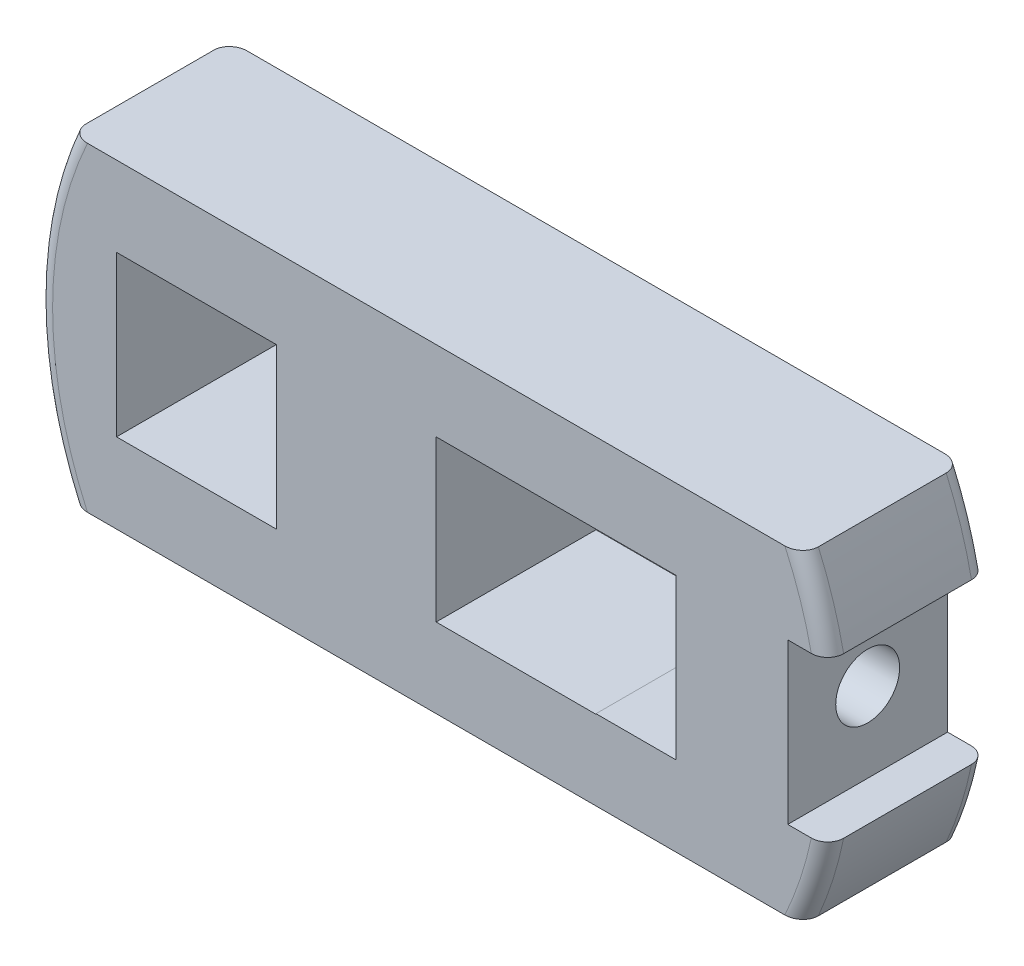
from build123d import *

# Parameters (mm, degrees)
SKETCH1_R               = 25
BOSS_EXTRUDE1_DEPTH     = 10
CUT_EXTRUDE1_DEPTH      = 37.742346142
CUT_EXTRUDE1_DEPTH_BACK = 37.742346142
CUT_EXTRUDE2_DEPTH      = 3
SKETCH5_R               = 2
CUT_EXTRUDE4_DEPTH      = 13
FILLET1_R               = 1
CUT_EXTRUDE6_DEPTH      = 3
CUT_EXTRUDE6_DEPTH_BACK = 3
SKETCH6_W               = 10
SKETCH6_H               = 10
SKETCH7_W               = 10
SKETCH7_H               = 30
BOSS_EXTRUDE2_DEPTH     = 10
SKETCH8_W               = 10
SKETCH8_H               = 10
BOSS_EXTRUDE3_DEPTH     = 10
SKETCH9_W               = 10
SKETCH9_H               = 10
CUT_EXTRUDE7_DEPTH      = 10
SKETCH10_W              = 83.743898857
SKETCH10_H              = 28.854414255
SKETCH10_W_2            = 82.461079615
SKETCH10_H_2            = 26.234851391
CUT_EXTRUDE8_DEPTH      = 10
SKETCH11_W              = 10
SKETCH11_H              = 10.032703296
CUT_EXTRUDE9_DEPTH      = 10


with BuildPart() as part:
    # Sketch1 → Boss-Extrude1 (new body)
    with BuildSketch(Plane.XY):
        Circle(SKETCH1_R)
    extrude(amount=BOSS_EXTRUDE1_DEPTH)

    # Sketch2 → Cut-Extrude1 (cut, two sides: drawn at the far end of the back side and taken through both)
    with BuildSketch(Plane.XY.offset(10).offset(-CUT_EXTRUDE1_DEPTH_BACK)):
        Polygon((5, -5), (15, -5), (15, 5), (5, 5), (5, 15), (-5, 15), (-5, 5), (-15, 5), (-15, -5), (-5, -5), (-5, -15), (5, -15), align=None)
    extrude(amount=CUT_EXTRUDE1_DEPTH + CUT_EXTRUDE1_DEPTH_BACK, mode=Mode.SUBTRACT)

    # Sketch4 → Cut-Extrude2 (cut)
    with BuildSketch(Plane.ZY.offset(-15)):
        Polygon((4.759098318, -4.265594884), (8.57366269, -2.341424419), (8.814564373, 1.924170465), (5.240901682, 4.265594884), (1.42633731, 2.341424419), (1.185435627, -1.924170465), align=None)
    extrude(amount=-CUT_EXTRUDE2_DEPTH, mode=Mode.SUBTRACT)

    # Sketch5 → Cut-Extrude4 (cut)
    with BuildSketch(Plane.ZY.offset(-18)):
        with Locations((5, 0)):
            Circle(SKETCH5_R)
    extrude(amount=-CUT_EXTRUDE4_DEPTH, mode=Mode.SUBTRACT)

    # Fillet1
    fillet1_edges = [part.edges().sort_by_distance(p)[0] for p in [
        (-25, 0, 0),
        (-25, 0, 10),
    ]]
    fillet(fillet1_edges, radius=FILLET1_R)

    # Sketch6 → Cut-Extrude6 (cut, two sides: drawn at the far end of the back side and taken through both)
    with BuildSketch(Plane.YZ.offset(24.999151456).offset(-CUT_EXTRUDE6_DEPTH_BACK)):
        with Locations((0, 5)):
            Rectangle(SKETCH6_W, SKETCH6_H)
    extrude(amount=CUT_EXTRUDE6_DEPTH + CUT_EXTRUDE6_DEPTH_BACK, mode=Mode.SUBTRACT)

    # Sketch7 → Boss-Extrude2 (add)
    with BuildSketch(Plane(origin=(0, 0, 0), x_dir=(-1, 0, 0), z_dir=(0, 0, -1))):
        Rectangle(SKETCH7_W, SKETCH7_H)
    extrude(amount=-BOSS_EXTRUDE2_DEPTH)

    # Sketch8 → Boss-Extrude3 (add)
    with BuildSketch(Plane(origin=(0, 0, 0), x_dir=(-1, 0, 0), z_dir=(0, 0, -1))):
        with Locations((10, 0)):
            Rectangle(SKETCH8_W, SKETCH8_H)
    extrude(amount=-BOSS_EXTRUDE3_DEPTH)

    # Sketch9 → Cut-Extrude7 (cut)
    with BuildSketch(Plane(origin=(0, 0, 0), x_dir=(-1, 0, 0), z_dir=(0, 0, -1))):
        with Locations((15, 0)):
            Rectangle(SKETCH9_W, SKETCH9_H)
    extrude(amount=-CUT_EXTRUDE7_DEPTH, mode=Mode.SUBTRACT)

    # Sketch10 → Cut-Extrude8 (cut)
    with BuildSketch(Plane(origin=(0, 0, 0), x_dir=(-1, 0, 0), z_dir=(0, 0, -1))):
        with Locations((0.995128198, 24.427207128)):
            Rectangle(SKETCH10_W, SKETCH10_H)
        with Locations((-3.54772161, -23.117425695)):
            Rectangle(SKETCH10_W_2, SKETCH10_H_2)
    extrude(amount=-CUT_EXTRUDE8_DEPTH, mode=Mode.SUBTRACT)

    # Sketch11 → Cut-Extrude9 (cut)
    with BuildSketch(Plane(origin=(0, 0, 0), x_dir=(-1, 0, 0), z_dir=(0, 0, -1))):
        with Locations((-5, -0.016351648)):
            Rectangle(SKETCH11_W, SKETCH11_H)
    extrude(amount=-CUT_EXTRUDE9_DEPTH, mode=Mode.SUBTRACT)


solid = part.part
